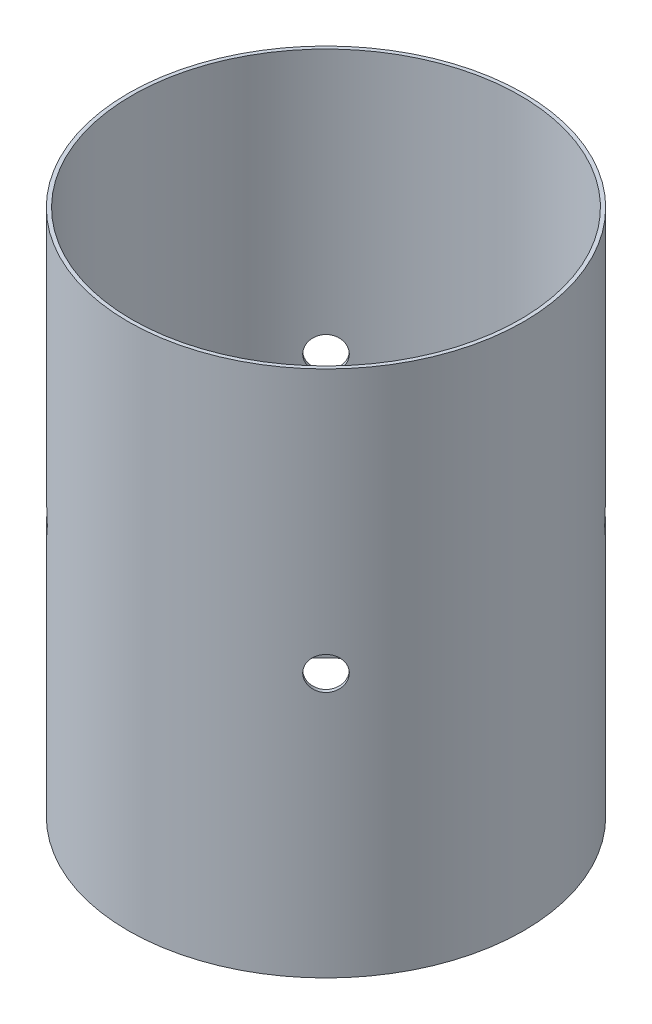
from build123d import *

# Parameters (mm, degrees)
SKETCH1_R           = 76.2
SKETCH1_R_2         = 74.7776
BOSS_EXTRUDE1_DEPTH = 101.6
SKETCH2_R           = 6.35
CUT_EXTRUDE1_DEPTH  = 5.08
CIRPATTERN1_COUNT   = 4


with BuildPart() as part:
    # Sketch1 → Boss-Extrude1 (new, symmetric)
    with BuildSketch(Plane(origin=(0, 0, 0), x_dir=(1, 0, 0), z_dir=(0, 1, 0))):
        with Locations(Location((0, 0, 0), (0, 0, 270))):
            Circle(SKETCH1_R)
        with Locations(Location((0, 0, 0), (0, 0, 270))):
            Circle(SKETCH1_R_2, mode=Mode.SUBTRACT)
    extrude(amount=BOSS_EXTRUDE1_DEPTH, both=True)

    # Sketch2 → Cut-Extrude1 (cut)
    with BuildSketch(Plane(origin=(54.887325412, 0, -54.887325412), x_dir=(0, -1, 0), z_dir=(0.7071067811865488, 0, -0.7071067811865464))):
        with Locations(Location((0, 0, 0), (0, 0, 90))):
            Circle(SKETCH2_R)
    cut_extrude1 = extrude(amount=-CUT_EXTRUDE1_DEPTH, mode=Mode.SUBTRACT)

    # CirPattern1: Cut-Extrude1 ×4 about axis
    cirpattern1_axis = Axis((0, 0, 0), (0, 1, 0))
    for i in range(1, CIRPATTERN1_COUNT):
        add(cut_extrude1.rotate(cirpattern1_axis, i * 360 / CIRPATTERN1_COUNT), mode=Mode.SUBTRACT)


solid = part.part
